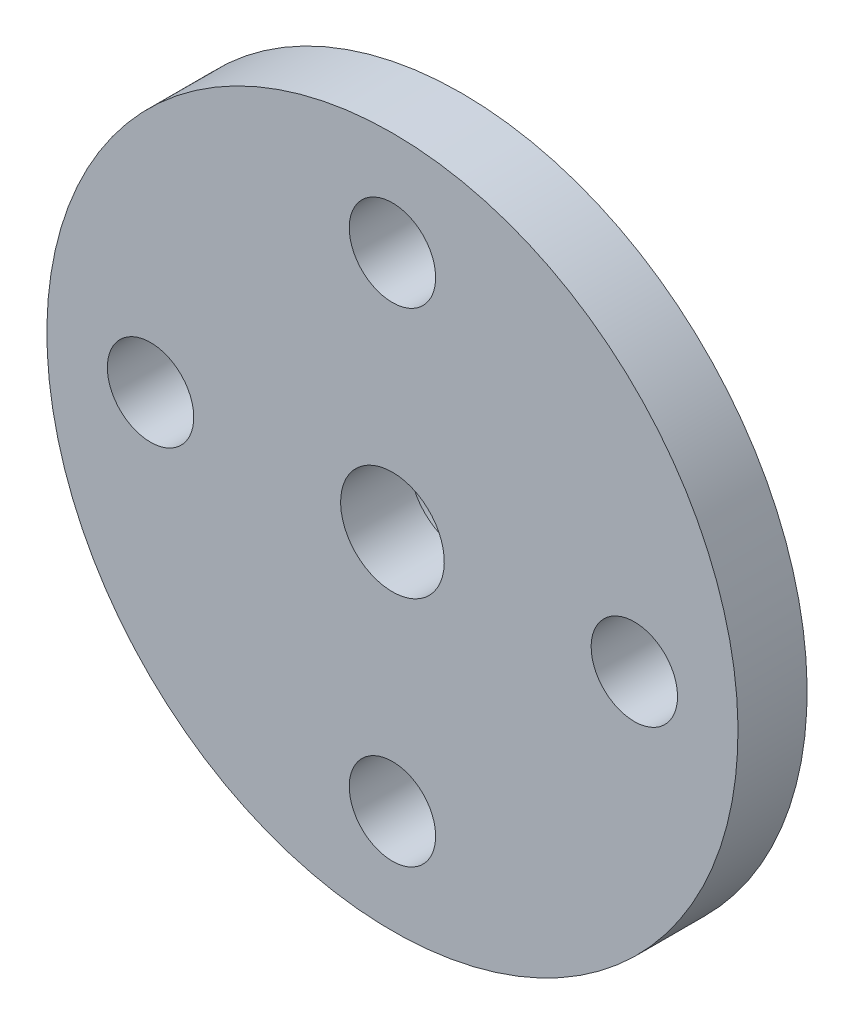
from build123d import *

# Parameters (mm, degrees)
PATTERN_CIRCULAR_1_COUNT = 4


with BuildPart() as part:
    # 草图2 → 旋转1 (revolve)
    with BuildSketch(Plane(origin=(0, 0, 0), x_dir=(0, 0, -1), z_dir=(1, 0, 0))):
        Polygon((-2, 1.5), (-2, 10), (0, 10), (0, 5), (3.5, 5), (3.5, 3), (0, 3), (0, 1.5), align=None)
    revolve(axis=Axis((0, 0, 0), (0, 0, 1)))

    # 草图4 → M3 螺纹孔1 (revolve, cut)
    with BuildSketch(Plane(origin=(0, 7, 2), x_dir=(0, -1, 0), z_dir=(1, 0, 0))):
        Polygon((0, 0), (0, 8.251075774), (1.25, 7.5), (1.25, 0), align=None)
    hole_wizard_m3_1 = revolve(axis=Axis((0, 7, 8.35), (0, 0, -1)), mode=Mode.SUBTRACT)

    # 阵列(圆周)1: M3 螺纹孔1 ×4 about axis
    pattern_circular_1_axis = Axis((0, 0, 0), (0, 0, 1))
    for i in range(1, PATTERN_CIRCULAR_1_COUNT):
        add(hole_wizard_m3_1.rotate(pattern_circular_1_axis, i * 360 / PATTERN_CIRCULAR_1_COUNT), mode=Mode.SUBTRACT)


solid = part.part
